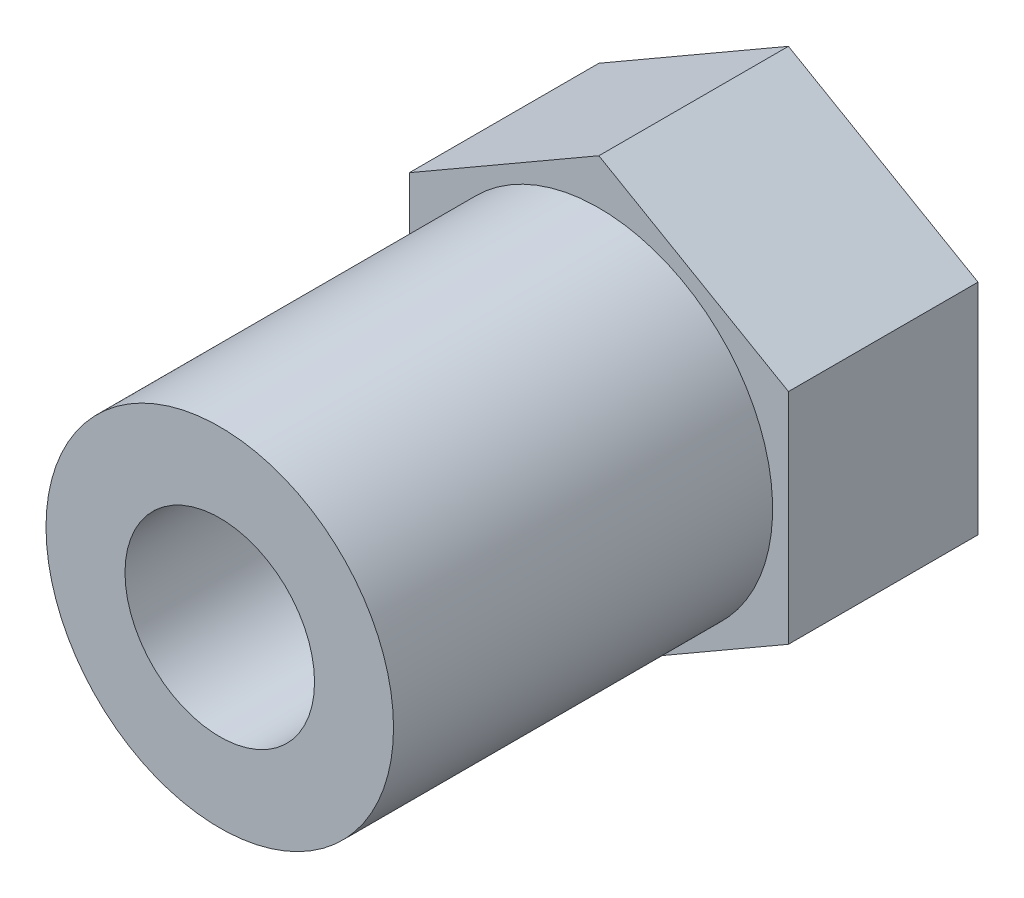
from build123d import *

# Parameters (mm, degrees)
CROQUIS2_R              = 5.5
SALIENTE_EXTRUIR1_DEPTH = 18
SALIENTE_EXTRUIR2_DEPTH = 6
CROQUIS4_R              = 3
CORTAR_EXTRUIR1_DEPTH   = 12
CROQUIS5_R              = 1.5
CORTAR_EXTRUIR2_DEPTH   = 6


with BuildPart() as part:
    # Croquis2 → Saliente-Extruir1 (new body)
    with BuildSketch(Plane.XY):
        Circle(CROQUIS2_R)
    extrude(amount=SALIENTE_EXTRUIR1_DEPTH)

    # Croquis3 → Saliente-Extruir2 (add)
    with BuildSketch(Plane(origin=(0, 0, 0), x_dir=(-1, 0, 0), z_dir=(0, 0, -1))):
        Polygon((0, 6.92820323), (-6, 3.464101615), (-6, -3.464101615), (0, -6.92820323), (6, -3.464101615), (6, 3.464101615), align=None)
    extrude(amount=-SALIENTE_EXTRUIR2_DEPTH)

    # Croquis4 → Cortar-Extruir1 (cut)
    with BuildSketch(Plane.XY.offset(18)):
        Circle(CROQUIS4_R)
    extrude(amount=-CORTAR_EXTRUIR1_DEPTH, mode=Mode.SUBTRACT)

    # Croquis5 → Cortar-Extruir2 (cut)
    with BuildSketch(Plane(origin=(0, 0, 0), x_dir=(-1, 0, 0), z_dir=(0, 0, -1))):
        Circle(CROQUIS5_R)
    extrude(amount=-CORTAR_EXTRUIR2_DEPTH, mode=Mode.SUBTRACT)


solid = part.part
